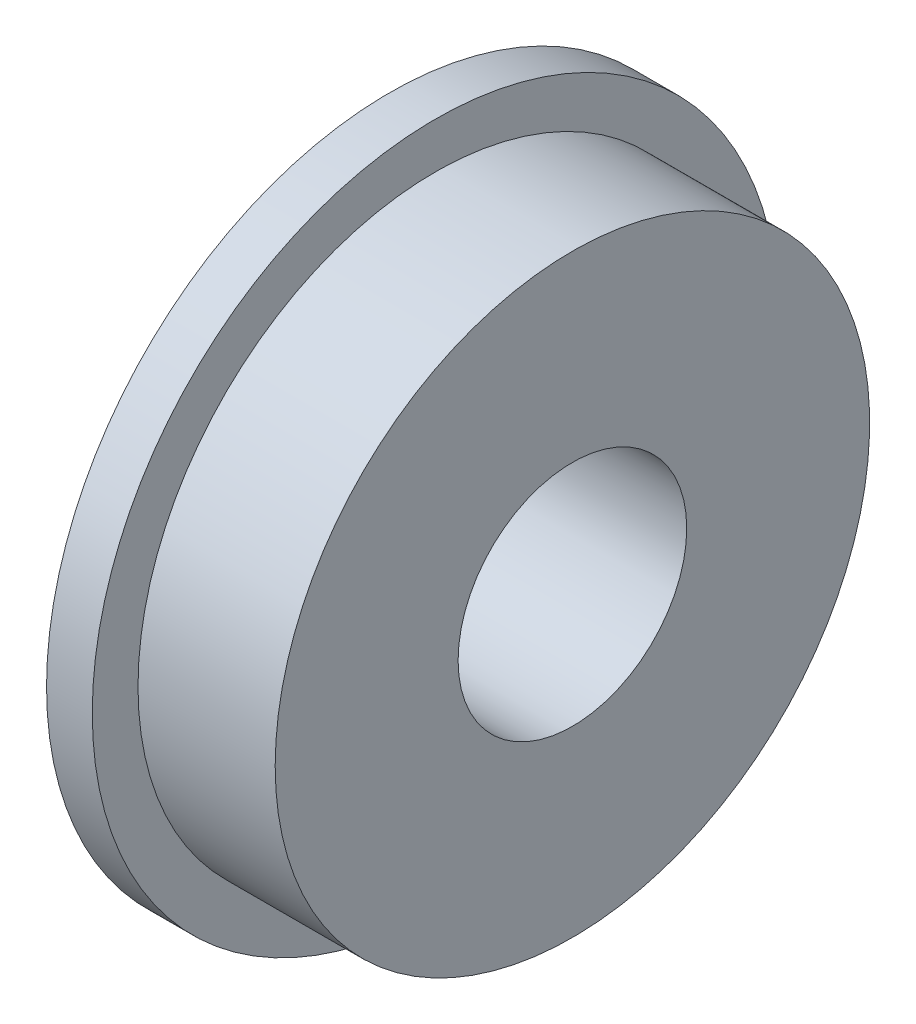
from build123d import *


with BuildPart() as part:
    # Sketch1 → Revolve1 (revolve)
    with BuildSketch(Plane(origin=(0, 0, 0), x_dir=(1, 0, 0), z_dir=(0, 1, 0)), mode=Mode.PRIVATE) as revolve1_sk:
        Polygon((4, 2.5), (0, 2.5), (0, 7.5), (1, 7.5), (1, 6.5), (4, 6.5), align=None)
    revolve(revolve1_sk.sketch.rotate(Axis((0, 0, 0), (1, 0, 0)), 180), axis=Axis((0, 0, 0), (1, 0, 0)))


solid = part.part
